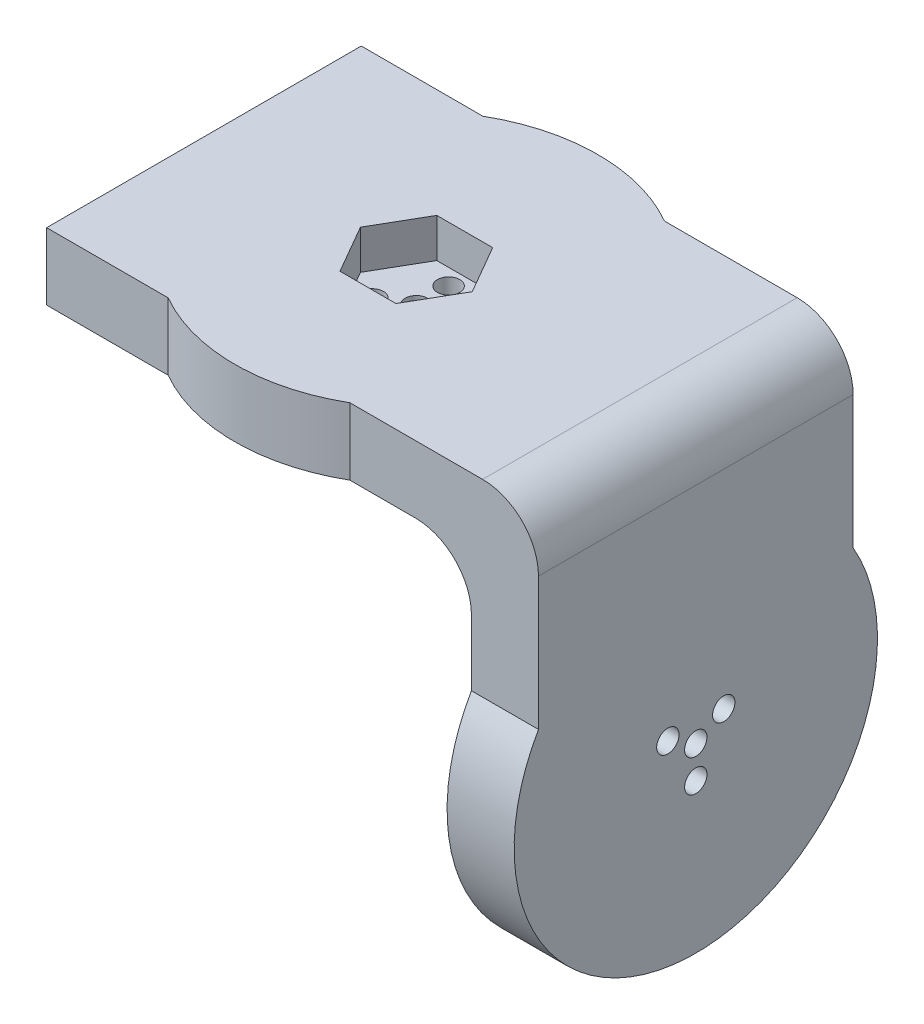
from build123d import *

# Parameters (mm, degrees)
EXTRUDE_1_DEPTH      = 12
CUT_EXTRUDE_2_DEPTH  = 7
SKETCH_4_W           = 12
SKETCH_4_H           = 56.291651246
EXTRUDE_2_DEPTH      = 85
EXTRUDE_3_DEPTH      = 12
CUT_EXTRUDE_4_DEPTH  = 12
FILLET_1_R           = 10
FILLET_2_R           = 10
SKETCH_8_R           = 2
CUT_EXTRUDE_9_DEPTH  = 5
CUT_EXTRUDE_7_DEPTH  = 7
SKETCH_3_R           = 2
CUT_EXTRUDE_8_DEPTH  = 5
EXTRUDE_START        = -12
EXTRUDE_5_DEPTH      = 12
SKETCH_13_R          = 3
CUT_EXTRUDE_11_DEPTH = 15


with BuildPart() as part:
    # 草图1 → 凸台-拉伸1 (new body)
    with BuildSketch(Plane(origin=(0, 0, 0), x_dir=(1, 0, 0), z_dir=(0, 1, 0))):
        with BuildLine():
            Line((16.25, -28.145825623), (0, 0))
            Line((0, 0), (16.25, 28.145825623))
            ThreePointArc((16.25, 28.145825623), (-32.5, 0), (16.25, -28.145825623))
        make_face()
        with BuildLine():
            Line((32.5, 0), (0, 0))
            Line((0, 0), (16.25, -28.145825623))
            ThreePointArc((16.25, -28.145825623), (28.145825623, -16.25), (32.5, 0))
        make_face()
        with BuildLine():
            Line((16.25, 28.145825623), (0, 0))
            Line((0, 0), (32.5, 0))
            ThreePointArc((32.5, 0), (28.145825623, 16.25), (16.25, 28.145825623))
        make_face()
        with BuildLine():
            ThreePointArc((16.25, 28.145825623), (28.145825623, 16.25), (32.5, 0))
            Line((32.5, 0), (50, 0))
            Line((50, 0), (50, 28.145825623))
            Line((50, 28.145825623), (16.25, 28.145825623))
        make_face()
        with BuildLine():
            Line((50, 0), (32.5, 0))
            ThreePointArc((32.5, 0), (28.145825623, -16.25), (16.25, -28.145825623))
            Line((16.25, -28.145825623), (50, -28.145825623))
            Line((50, -28.145825623), (50, 0))
        make_face()
    extrude(amount=EXTRUDE_1_DEPTH)

    # 草图2 → 切除-拉伸2 (cut)
    with BuildSketch(Plane(origin=(0, 12, 0), x_dir=(1, 0, 0), z_dir=(0, 1, 0))):
        Polygon((5, -8.660254038), (10, 0), (5, 8.660254038), (-5, 8.660254038), (-10, 0), (-5, -8.660254038), align=None)
    extrude(amount=-CUT_EXTRUDE_2_DEPTH, mode=Mode.SUBTRACT)

    # 草图4 → 凸台-拉伸2 (add)
    with BuildSketch(Plane.XZ):
        with Locations((44, 0)):
            Rectangle(SKETCH_4_W, SKETCH_4_H)
    extrude(amount=EXTRUDE_2_DEPTH)

    # 草图6 → 凸台-拉伸3 (add)
    with BuildSketch(Plane(origin=(50, 0, 0), x_dir=(0, 0, -1), z_dir=(1, 0, 0))):
        with BuildLine():
            ThreePointArc((-28.145825623, -21.75), (-32.5, -38), (-28.145825623, -54.25))
            Line((-28.145825623, -54.25), (-28.145825623, -21.75))
        make_face()
        with BuildLine():
            ThreePointArc((28.145825623, -54.25), (31.392589354, -46.411618966), (32.5, -38))
            ThreePointArc((32.5, -38), (31.392589354, -29.588381034), (28.145825623, -21.75))
            Line((28.145825623, -21.75), (28.145825623, -54.25))
        make_face()
    extrude(amount=-EXTRUDE_3_DEPTH)

    # 草图7 → 切除-拉伸4 (cut)
    with BuildSketch(Plane(origin=(50, 0, 0), x_dir=(0, 0, -1), z_dir=(1, 0, 0))):
        with BuildLine():
            Line((28.145825623, -85), (28.145825623, -54.25))
            ThreePointArc((28.145825623, -54.25), (0, -70.5), (-28.145825623, -54.25))
            Line((-28.145825623, -54.25), (-28.145825623, -85))
            Line((-28.145825623, -85), (28.145825623, -85))
        make_face()
    extrude(amount=-CUT_EXTRUDE_4_DEPTH, mode=Mode.SUBTRACT)

    # 圆角1
    fillet_1_edges = [part.edges().sort_by_distance(p)[0] for p in [
        (38, 0, 0),
    ]]
    fillet(fillet_1_edges, radius=FILLET_1_R)

    # 圆角2
    fillet_2_edges = [part.edges().sort_by_distance(p)[0] for p in [
        (50, 12, 0),
    ]]
    fillet(fillet_2_edges, radius=FILLET_2_R)

    # 草图8 → 切除-拉伸9 (cut)
    with BuildSketch(Plane(origin=(50, 0, 0), x_dir=(0, 0, -1), z_dir=(1, 0, 0))):
        with Locations((0, -38)):
            Circle(SKETCH_8_R)
        with Locations((0, -43.773502692)):
            Circle(SKETCH_8_R)
        with Locations((5, -35.113248654)):
            Circle(SKETCH_8_R)
        with Locations((-5, -35.113248654)):
            Circle(SKETCH_8_R)
    extrude(amount=-CUT_EXTRUDE_9_DEPTH, mode=Mode.SUBTRACT)

    # 草图10 → 切除-拉伸7 (cut)
    with BuildSketch(Plane.ZY.offset(-38)):
        Polygon((10, -38), (5, -29.339745962), (-5, -29.339745962), (-10, -38), (-5, -46.660254038), (5, -46.660254038), align=None)
    extrude(amount=-CUT_EXTRUDE_7_DEPTH, mode=Mode.SUBTRACT)

    # 草图3 → 切除-拉伸8 (cut)
    with BuildSketch(Plane.XZ):
        with Locations(Location((0, 0, 0), (0, 0, 270))):
            Circle(SKETCH_3_R)
        with Locations(Location((0, -5.773502692, 0), (0, 0, 270))):
            Circle(SKETCH_3_R)
        with Locations(Location((5, 2.886751346, 0), (0, 0, 270))):
            Circle(SKETCH_3_R)
        with Locations(Location((-5, 2.886751346, 0), (0, 0, 270))):
            Circle(SKETCH_3_R)
    extrude(amount=-CUT_EXTRUDE_8_DEPTH, mode=Mode.SUBTRACT)

    # 草图12 → 凸台-拉伸5 (add)
    with BuildSketch(Plane(origin=(0, 12, 0), x_dir=(1, 0, 0), z_dir=(0, 1, 0)).offset(EXTRUDE_START)):
        with BuildLine():
            ThreePointArc((-16.25, -28.145825623), (-28.145825623, -16.25), (-32.5, 0))
            Line((-32.5, 0), (-38, 0))
            Line((-38, 0), (-38, -28.145825623))
            Line((-38, -28.145825623), (-16.25, -28.145825623))
        make_face()
        with BuildLine():
            Line((-38, 0), (-32.5, 0))
            ThreePointArc((-32.5, 0), (-28.145825623, 16.25), (-16.25, 28.145825623))
            Line((-16.25, 28.145825623), (-38, 28.145825623))
            Line((-38, 28.145825623), (-38, 0))
        make_face()
    extrude(amount=EXTRUDE_5_DEPTH)

    # 草图13 → 切除-拉伸11 (cut)
    with BuildSketch(Plane.ZY.offset(38)):
        with Locations((-20, 6)):
            Circle(SKETCH_13_R)
        with Locations((20, 6)):
            Circle(SKETCH_13_R)
        with Locations((0, 6)):
            Circle(SKETCH_13_R)
    extrude(amount=-CUT_EXTRUDE_11_DEPTH, mode=Mode.SUBTRACT)


solid = part.part
